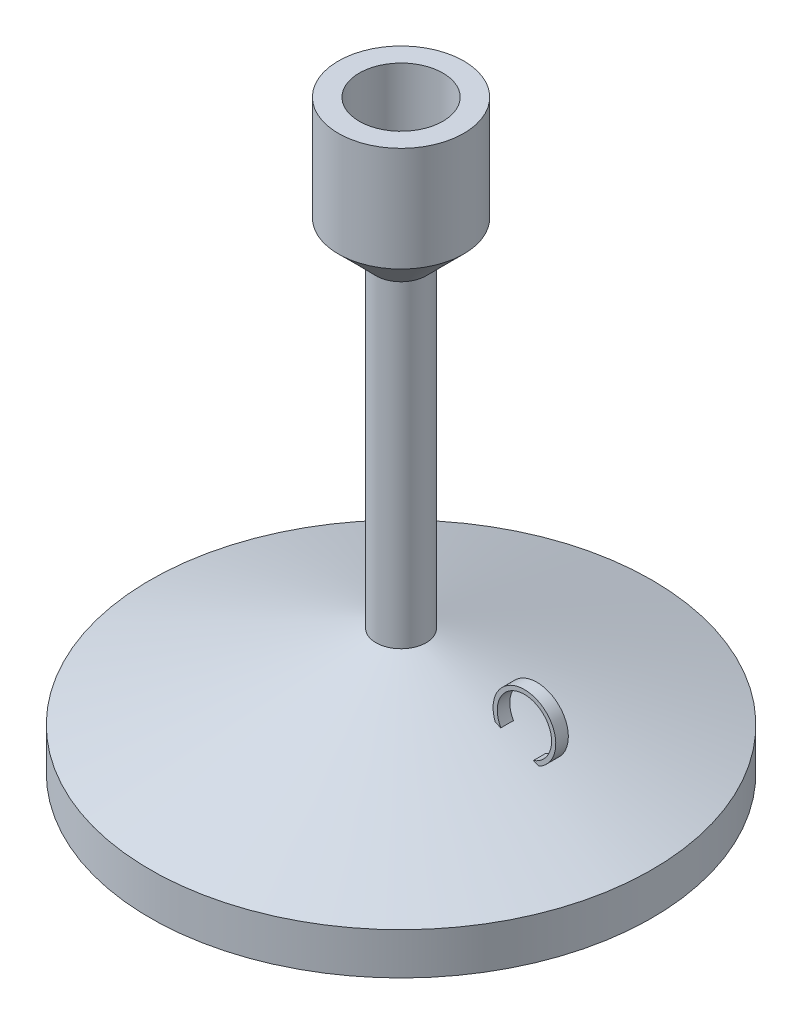
from build123d import *

# Parameters (mm, degrees)
SKETCH2_R           = 10
CUT_EXTRUDE2_DEPTH  = 20
SKETCH3_R           = 7.5
SKETCH3_R_2         = 6.5
BOSS_EXTRUDE2_DEPTH = 1.5


with BuildPart() as part:
    # Sketch1 → Revolve1 (revolve)
    with BuildSketch(Plane.XY, mode=Mode.PRIVATE) as revolve1_sk:
        Polygon((0, 140), (-15, 140), (-15, 115), (-6, 106), (-6, 30), (-60, 10), (-60, 0), (0, 0), align=None)
    revolve(revolve1_sk.sketch.rotate(Axis((0, 0, 0), (0, 1, 0)), 270), axis=Axis((0, 0, 0), (0, 1, 0)))

    # Sketch2 → Cut-Extrude2 (cut)
    with BuildSketch(Plane(origin=(0, 140, 0), x_dir=(1, 0, 0), z_dir=(0, 1, 0))):
        with Locations(Location((0, 0, 0), (0, 0, 270))):
            Circle(SKETCH2_R)
    extrude(amount=-CUT_EXTRUDE2_DEPTH, mode=Mode.SUBTRACT)

    # Sketch3 → Boss-Extrude2 (add, symmetric)
    with BuildSketch(Plane.XY):
        with Locations((31, 26.072659277)):
            Circle(SKETCH3_R)
        with Locations((31, 26.072659277)):
            Circle(SKETCH3_R_2, mode=Mode.SUBTRACT)
    extrude(amount=BOSS_EXTRUDE2_DEPTH, both=True)


solid = part.part
